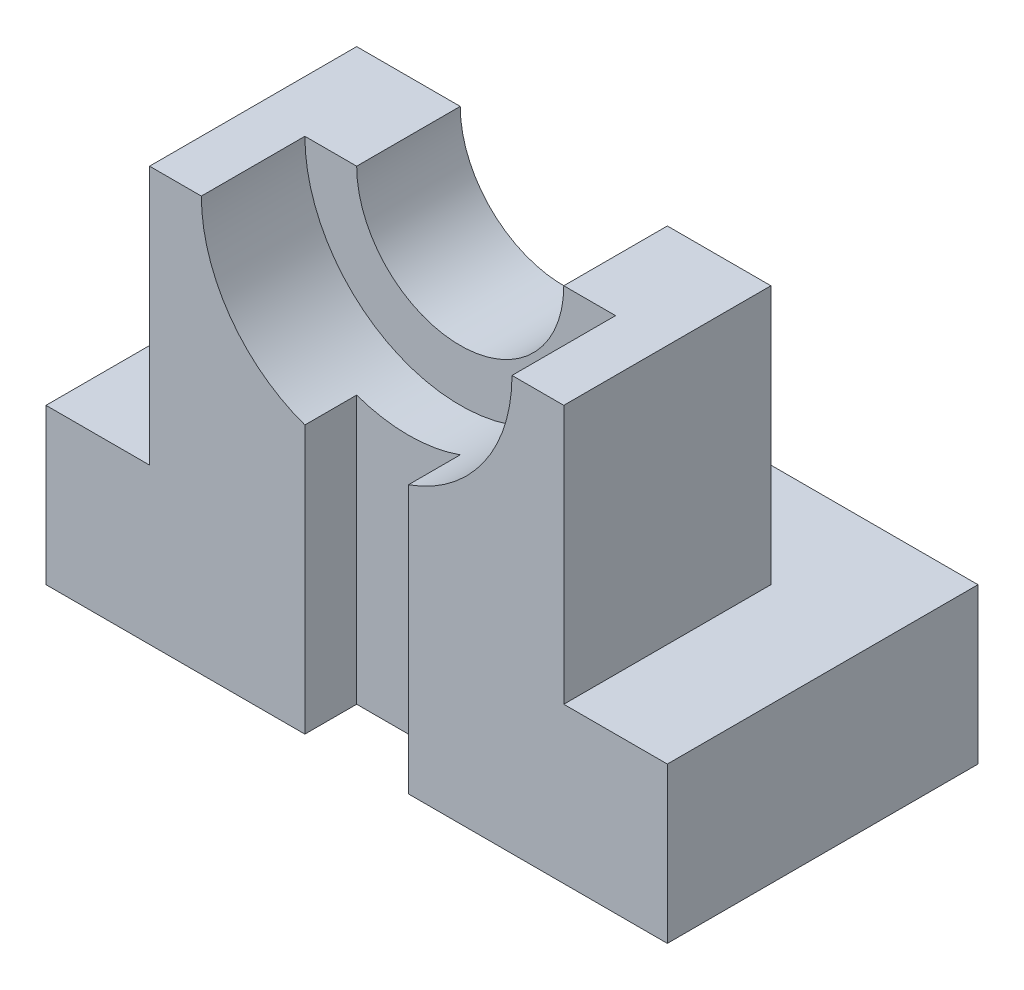
from build123d import *

# Parameters (mm, degrees)
SKETCH1_W                = 40
SKETCH1_H                = 25
BOSS_EXTRUDE1_DEPTH      = 20
BOSS_EXTRUDE2_DEPTH      = 20
BOSS_EXTRUDE2_DEPTH_BACK = 10
SKETCH2_R                = 10
CUT_EXTRUDE1_DEPTH       = 59.309518948
SKETCH3_W                = 10
SKETCH3_H                = 5
CUT_EXTRUDE2_DEPTH       = 54.851648071
SKETCH4_R                = 15
CUT_EXTRUDE3_DEPTH       = 10


with BuildPart() as part:
    # Sketch1 → Boss-Extrude1 (new body)
    with BuildSketch(Plane.XY):
        with Locations((0, -12.5)):
            Rectangle(SKETCH1_W, SKETCH1_H)
    extrude(amount=BOSS_EXTRUDE1_DEPTH)

    # Sketch1<3> → Boss-Extrude2 (add, two sides: drawn at the far end of the back side and taken through both)
    with BuildSketch(Plane.XY.offset(-BOSS_EXTRUDE2_DEPTH_BACK)):
        Polygon((20, -25), (-20, -25), (-30, -25), (-30, -40), (30, -40), (30, -25), align=None)
    extrude(amount=BOSS_EXTRUDE2_DEPTH + BOSS_EXTRUDE2_DEPTH_BACK)

    # Sketch2 → Cut-Extrude1 (cut, through all)
    with BuildSketch(Plane.XY.offset(20)):
        Circle(SKETCH2_R)
    extrude(amount=-CUT_EXTRUDE1_DEPTH, mode=Mode.SUBTRACT)

    # Sketch3 → Cut-Extrude2 (cut, through all)
    with BuildSketch(Plane(origin=(0, 0, 0), x_dir=(1, 0, 0), z_dir=(0, 1, 0))):
        with Locations((0, -17.5)):
            Rectangle(SKETCH3_W, SKETCH3_H)
    extrude(amount=-CUT_EXTRUDE2_DEPTH, mode=Mode.SUBTRACT)

    # Sketch4 → Cut-Extrude3 (cut)
    with BuildSketch(Plane.XY.offset(20)):
        Circle(SKETCH4_R)
    extrude(amount=-CUT_EXTRUDE3_DEPTH, mode=Mode.SUBTRACT)


solid = part.part
